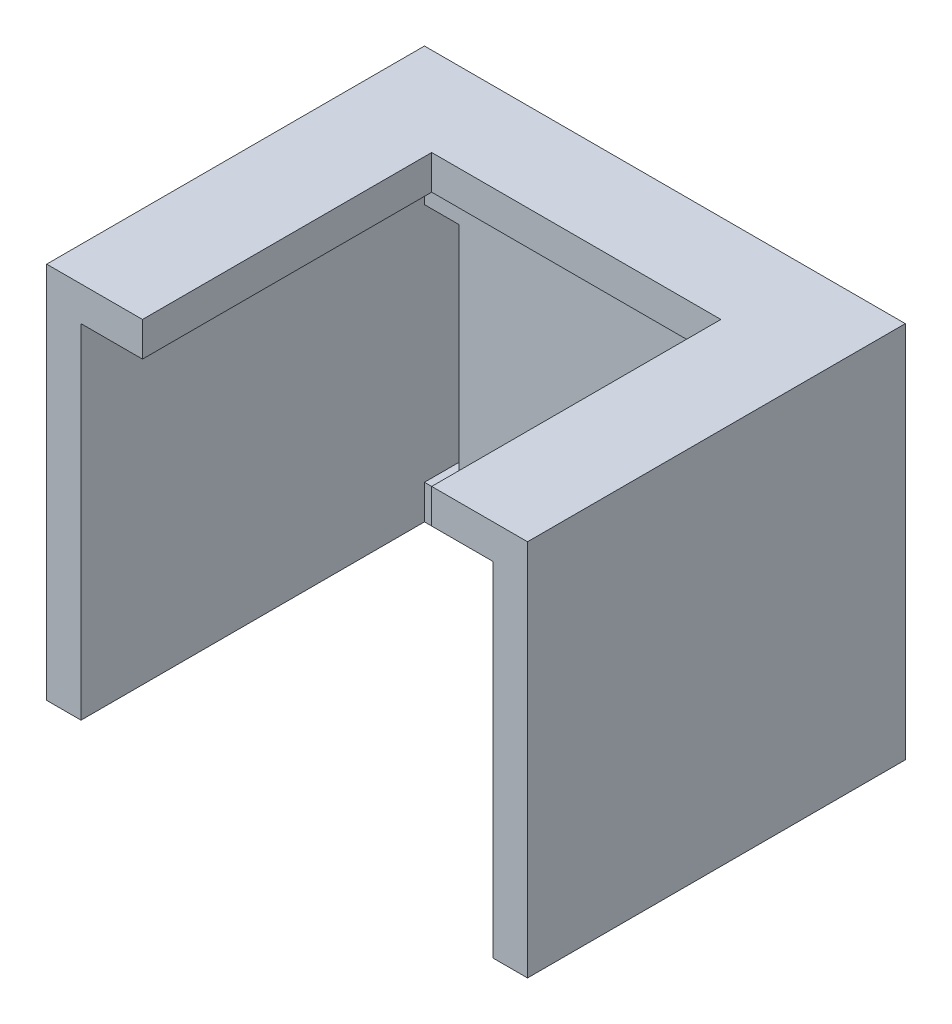
from build123d import *

# Parameters (mm, degrees)
SKETCH1_W           = 70
SKETCH1_H           = 55
BOSS_EXTRUDE1_DEPTH = 5
SKETCH2_W           = 5
SKETCH2_H           = 45
SKETCH2_W_2         = 5.019591865
CUT_EXTRUDE1_DEPTH  = 5
BOSS_EXTRUDE4_DEPTH = 50
SKETCH7_W           = 42.1
SKETCH7_H           = 42.1
CUT_EXTRUDE2_DEPTH  = 5
SKETCH9_W           = 5
SKETCH9_H           = 10
BOSS_EXTRUDE5_DEPTH = 5
SKETCH11_W          = 5
SKETCH11_H          = 10
BOSS_EXTRUDE6_DEPTH = 5


with BuildPart() as part:
    # Sketch1 → Boss-Extrude1 (new body)
    with BuildSketch(Plane.XY):
        with Locations((-35, 27.5)):
            Rectangle(SKETCH1_W, SKETCH1_H)
    extrude(amount=BOSS_EXTRUDE1_DEPTH)

    # Sketch2 → Cut-Extrude1 (cut)
    with BuildSketch(Plane.XY.offset(5)):
        with Locations((-62.5, 27.5)):
            Rectangle(SKETCH2_W, SKETCH2_H)
        with Locations((-7.509795933, 27.5)):
            Rectangle(SKETCH2_W_2, SKETCH2_H)
    extrude(amount=-CUT_EXTRUDE1_DEPTH, mode=Mode.SUBTRACT)

    # Sketch6 → Boss-Extrude4 (add)
    with BuildSketch(Plane.XY.offset(5)):
        Polygon((-70, 0), (-65, 0), (-65, 50), (-5, 50), (-5, 0), (0, 0), (0, 55), (-5, 55), (-65, 55), (-70, 55), align=None)
    extrude(amount=BOSS_EXTRUDE4_DEPTH)

    # Sketch7 → Cut-Extrude2 (cut)
    with BuildSketch(Plane(origin=(0, 55, 0), x_dir=(1, 0, 0), z_dir=(0, 1, 0))):
        with Locations((-35, -33.95)):
            Rectangle(SKETCH7_W, SKETCH7_H)
    extrude(amount=-CUT_EXTRUDE2_DEPTH, mode=Mode.SUBTRACT)

    # Sketch9 → Boss-Extrude5 (add)
    with BuildSketch(Plane.ZY.offset(60)):
        with Locations((2.5, 45)):
            Rectangle(SKETCH9_W, SKETCH9_H)
    extrude(amount=BOSS_EXTRUDE5_DEPTH)

    # Sketch11 → Boss-Extrude6 (add)
    with BuildSketch(Plane(origin=(-10.019591865, 0, 0), x_dir=(0, 0, -1), z_dir=(1, 0, 0))):
        with Locations((-2.5, 45)):
            Rectangle(SKETCH11_W, SKETCH11_H)
    extrude(amount=BOSS_EXTRUDE6_DEPTH)


solid = part.part
